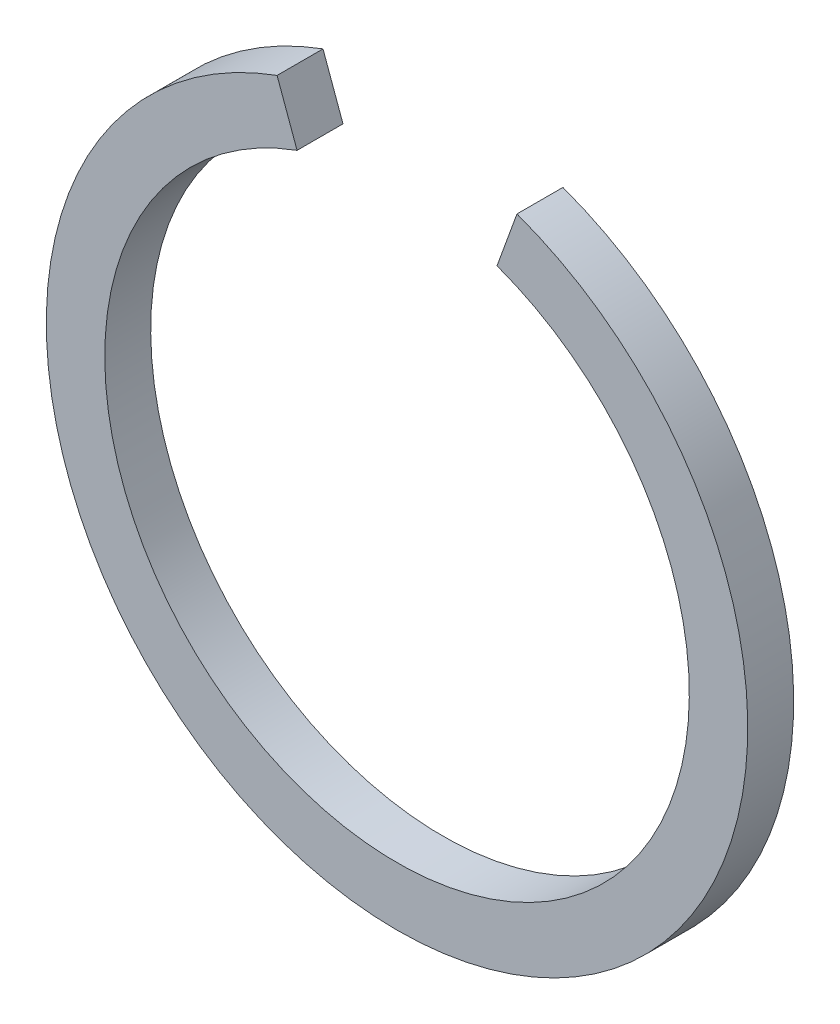
from build123d import *

# Parameters (mm, degrees)
SKETCH_1_R          = 8.4
SKETCH_1_R_2        = 7
EXTRUDE_1_DEPTH     = 1.1
CUT_EXTRUDE_START   = -10
CUT_EXTRUDE_1_DEPTH = 10


with BuildPart() as part:
    # 草图1 → 凸台-拉伸1 (new body)
    with BuildSketch(Plane.XY):
        Circle(SKETCH_1_R)
        Circle(SKETCH_1_R_2, mode=Mode.SUBTRACT)
    extrude(amount=EXTRUDE_1_DEPTH)

    # 草图2 → 切除-拉伸1 (cut)
    with BuildSketch(Plane.XY.offset(1.1).offset(CUT_EXTRUDE_START)):
        with BuildLine():
            Line((-2.394141003, 6.577848346), (-2.872969204, 7.893418015))
            ThreePointArc((-2.872969204, 7.893418015), (0, 8.4), (2.872969204, 7.893418015))
            Line((2.872969204, 7.893418015), (2.394141003, 6.577848346))
            ThreePointArc((2.394141003, 6.577848346), (0, 7), (-2.394141003, 6.577848346))
        make_face()
    extrude(amount=CUT_EXTRUDE_1_DEPTH, mode=Mode.SUBTRACT)


solid = part.part
